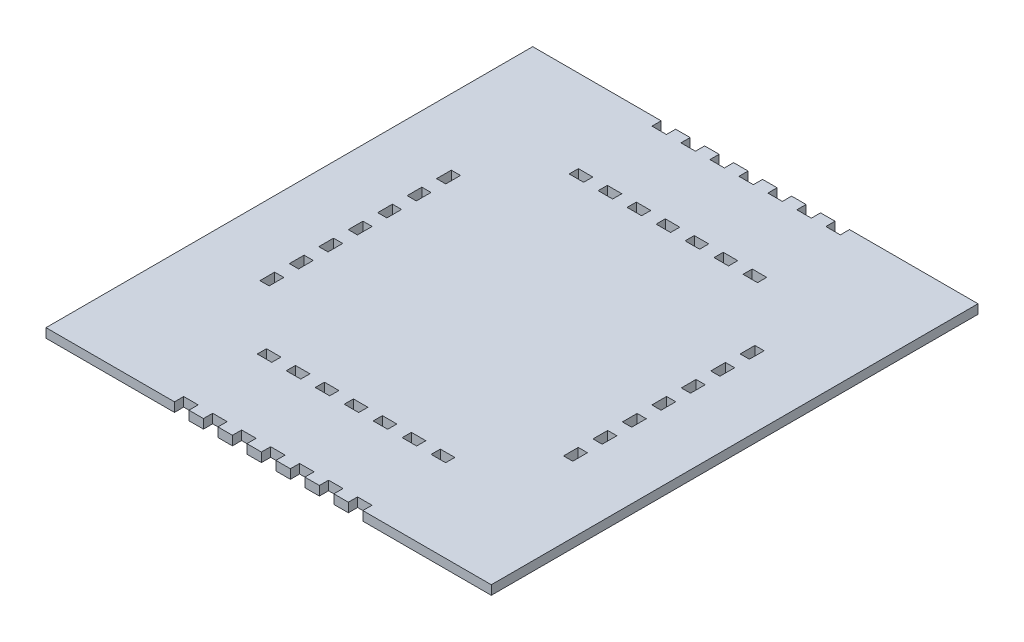
from build123d import *

# Parameters (mm, degrees)
SKETCH1_W           = 5
SKETCH1_H           = 3.175
SKETCH1_W_2         = 3.175
SKETCH1_H_2         = 5.08
BOSS_EXTRUDE1_DEPTH = 3.175


with BuildPart() as part:
    # Sketch1 → Boss-Extrude1 (new body)
    with BuildSketch(Plane(origin=(0, 0, 0), x_dir=(1, 0, 0), z_dir=(0, 1, 0))):
        Polygon((-34.46085268, -83.030846574), (-34.46085268, -79.855846574), (-29.46085268, -79.855846574), (-29.46085268, -83.030846574), (-24.46085268, -83.030846574), (-24.46085268, -79.855846574), (-19.46085268, -79.855846574), (-19.46085268, -83.030846574), (-14.46085268, -83.030846574), (-14.46085268, -79.855846574), (-9.46085268, -79.855846574), (-9.46085268, -83.030846574), (-4.46085268, -83.030846574), (-4.46085268, -79.855846574), (0.53914732, -79.855846574), (0.53914732, -83.030846574), (5.53914732, -83.030846574), (5.53914732, -79.855846574), (10.53914732, -79.855846574), (10.53914732, -83.030846574), (15.53914732, -83.030846574), (15.53914732, -79.855846574), (20.53914732, -79.855846574), (20.53914732, -83.030846574), (25.53914732, -83.030846574), (25.53914732, -79.855846574), (30.53914732, -79.855846574), (30.53914732, -83.030846574), (74.87414732, -83.030846574), (74.87414732, 84.926653426), (30.53914732, 84.926653426), (30.53914732, 81.751653426), (25.53914732, 81.751653426), (25.53914732, 84.926653426), (20.53914732, 84.926653426), (20.53914732, 81.751653426), (15.53914732, 81.751653426), (15.53914732, 84.926653426), (10.53914732, 84.926653426), (10.53914732, 81.751653426), (5.53914732, 81.751653426), (5.53914732, 84.926653426), (0.53914732, 84.926653426), (0.53914732, 81.751653426), (-4.46085268, 81.751653426), (-4.46085268, 84.926653426), (-9.46085268, 84.926653426), (-9.46085268, 81.751653426), (-14.46085268, 81.751653426), (-14.46085268, 84.926653426), (-19.46085268, 84.926653426), (-19.46085268, 81.751653426), (-24.46085268, 81.751653426), (-24.46085268, 84.926653426), (-29.46085268, 84.926653426), (-29.46085268, 81.751653426), (-34.46085268, 81.751653426), (-34.46085268, 84.926653426), (-78.79585268, 84.926653426), (-78.79585268, -83.030846574), align=None)
        with Locations((-21.96085268, 54.764153426)):
            Rectangle(SKETCH1_W, SKETCH1_H, mode=Mode.SUBTRACT)
        with Locations((-31.96085268, 54.764153426)):
            Rectangle(SKETCH1_W, SKETCH1_H, mode=Mode.SUBTRACT)
        with Locations((-11.96085268, 54.764153426)):
            Rectangle(SKETCH1_W, SKETCH1_H, mode=Mode.SUBTRACT)
        with Locations((-1.96085268, 54.764153426)):
            Rectangle(SKETCH1_W, SKETCH1_H, mode=Mode.SUBTRACT)
        with Locations((8.03914732, 54.764153426)):
            Rectangle(SKETCH1_W, SKETCH1_H, mode=Mode.SUBTRACT)
        with Locations((18.03914732, 54.764153426)):
            Rectangle(SKETCH1_W, SKETCH1_H, mode=Mode.SUBTRACT)
        with Locations((28.03914732, 54.764153426)):
            Rectangle(SKETCH1_W, SKETCH1_H, mode=Mode.SUBTRACT)
        with Locations((-21.96085268, -52.868346574)):
            Rectangle(SKETCH1_W, SKETCH1_H, mode=Mode.SUBTRACT)
        with Locations((-31.96085268, -52.868346574)):
            Rectangle(SKETCH1_W, SKETCH1_H, mode=Mode.SUBTRACT)
        with Locations((-11.96085268, -52.868346574)):
            Rectangle(SKETCH1_W, SKETCH1_H, mode=Mode.SUBTRACT)
        with Locations((-1.96085268, -52.868346574)):
            Rectangle(SKETCH1_W, SKETCH1_H, mode=Mode.SUBTRACT)
        with Locations((8.03914732, -52.868346574)):
            Rectangle(SKETCH1_W, SKETCH1_H, mode=Mode.SUBTRACT)
        with Locations((18.03914732, -52.868346574)):
            Rectangle(SKETCH1_W, SKETCH1_H, mode=Mode.SUBTRACT)
        with Locations((28.03914732, -52.868346574)):
            Rectangle(SKETCH1_W, SKETCH1_H, mode=Mode.SUBTRACT)
        with Locations((-54.34835268, 21.267903426)):
            Rectangle(SKETCH1_W_2, SKETCH1_H_2, mode=Mode.SUBTRACT)
        with Locations((-54.34835268, 31.427903426)):
            Rectangle(SKETCH1_W_2, SKETCH1_H_2, mode=Mode.SUBTRACT)
        with Locations((-54.34835268, 11.107903426)):
            Rectangle(SKETCH1_W_2, SKETCH1_H_2, mode=Mode.SUBTRACT)
        with Locations((-54.34835268, 0.947903426)):
            Rectangle(SKETCH1_W_2, SKETCH1_H_2, mode=Mode.SUBTRACT)
        with Locations((-54.34835268, -9.212096574)):
            Rectangle(SKETCH1_W_2, SKETCH1_H_2, mode=Mode.SUBTRACT)
        with Locations((-54.34835268, -19.372096574)):
            Rectangle(SKETCH1_W_2, SKETCH1_H_2, mode=Mode.SUBTRACT)
        with Locations((-54.34835268, -29.532096574)):
            Rectangle(SKETCH1_W_2, SKETCH1_H_2, mode=Mode.SUBTRACT)
        with Locations((50.42664732, -29.532096574)):
            Rectangle(SKETCH1_W_2, SKETCH1_H_2, mode=Mode.SUBTRACT)
        with Locations((50.42664732, -19.372096574)):
            Rectangle(SKETCH1_W_2, SKETCH1_H_2, mode=Mode.SUBTRACT)
        with Locations((50.42664732, -9.212096574)):
            Rectangle(SKETCH1_W_2, SKETCH1_H_2, mode=Mode.SUBTRACT)
        with Locations((50.42664732, 0.947903426)):
            Rectangle(SKETCH1_W_2, SKETCH1_H_2, mode=Mode.SUBTRACT)
        with Locations((50.42664732, 11.107903426)):
            Rectangle(SKETCH1_W_2, SKETCH1_H_2, mode=Mode.SUBTRACT)
        with Locations((50.42664732, 21.267903426)):
            Rectangle(SKETCH1_W_2, SKETCH1_H_2, mode=Mode.SUBTRACT)
        with Locations((50.42664732, 31.427903426)):
            Rectangle(SKETCH1_W_2, SKETCH1_H_2, mode=Mode.SUBTRACT)
    extrude(amount=BOSS_EXTRUDE1_DEPTH)


solid = part.part
